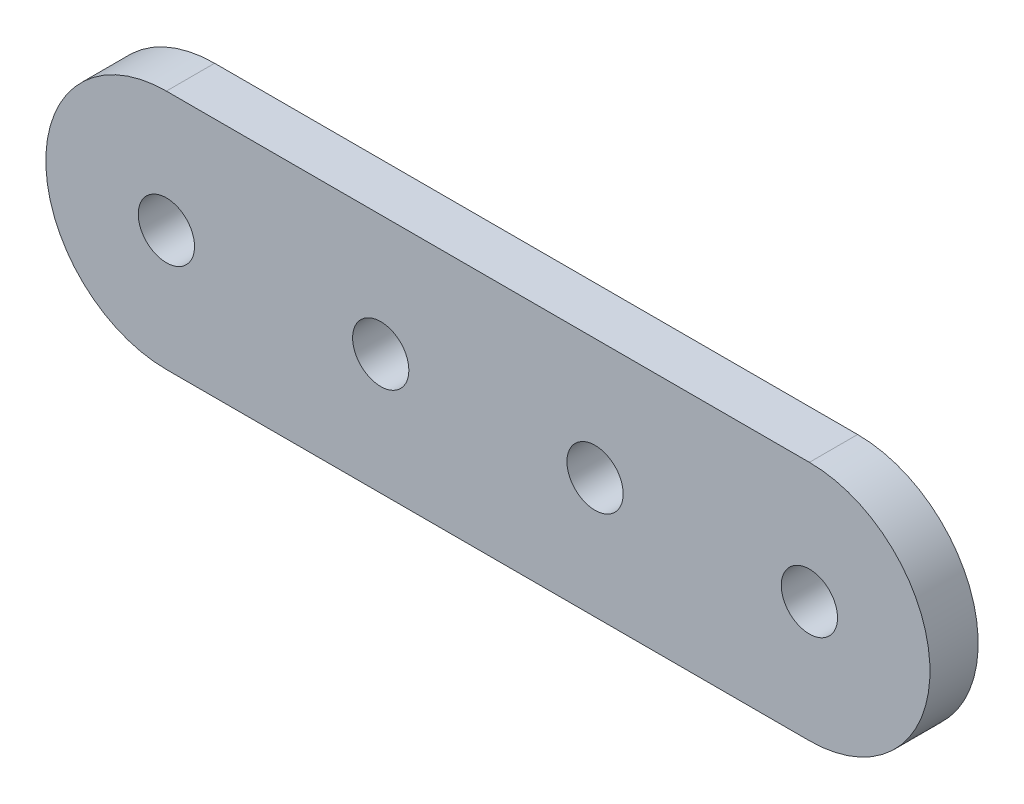
from build123d import *

# Parameters (mm, degrees)
SKETCH_1_R      = 1.75
EXTRUDE_1_DEPTH = 3


with BuildPart() as part:
    # 草圖1 → 伸長1 (new body)
    with BuildSketch(Plane.XY):
        with BuildLine():
            Line((-20, 7.5), (20, 7.5))
            ThreePointArc((20, 7.5), (27.5, 0), (20, -7.5))
            Line((20, -7.5), (-20, -7.5))
            ThreePointArc((-20, -7.5), (-27.5, 0), (-20, 7.5))
        make_face()
        with Locations((-20, 0)):
            Circle(SKETCH_1_R, mode=Mode.SUBTRACT)
        with Locations((20, 0)):
            Circle(SKETCH_1_R, mode=Mode.SUBTRACT)
        with Locations((-6.666666667, 0)):
            Circle(SKETCH_1_R, mode=Mode.SUBTRACT)
        with Locations((6.666666667, 0)):
            Circle(SKETCH_1_R, mode=Mode.SUBTRACT)
    extrude(amount=EXTRUDE_1_DEPTH)


solid = part.part
